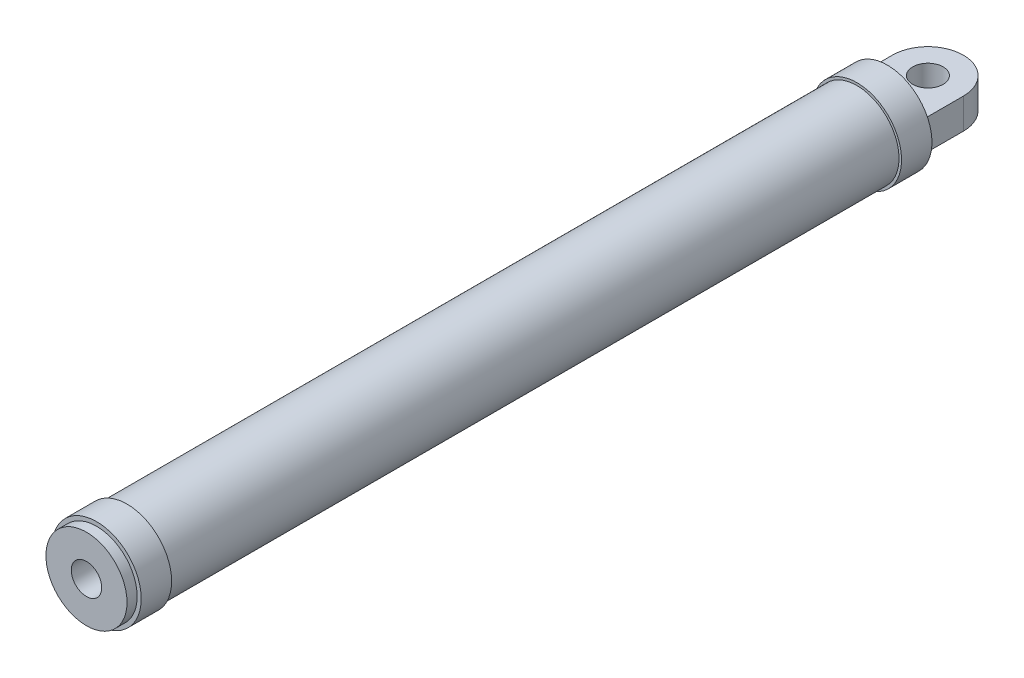
from build123d import *

# Parameters (mm, degrees)
SKETCH_1_R          = 41.5
EXTRUDE_1_DEPTH     = 720
SKETCH_2_R          = 44
EXTRUDE_2_DEPTH     = 30
EXTRUDE_START       = 30
SKETCH_3_R          = 44
EXTRUDE_3_DEPTH     = 30
SKETCH_4_R          = 40
EXTRUDE_4_DEPTH     = 10
SKETCH_6_R          = 15
EXTRUDE_6_DEPTH     = 15
SKETCH_5_R          = 15
CUT_EXTRUDE_1_DEPTH = 220


with BuildPart() as part:
    # 草图1 → 拉伸1 (new body)
    with BuildSketch(Plane.XY):
        with Locations(Location((0, 0, 0), (0, 0, 180))):
            Circle(SKETCH_1_R)
    extrude(amount=EXTRUDE_1_DEPTH)

    # 草图2 → 拉伸2 (add)
    with BuildSketch(Plane.XY.offset(720)):
        Circle(SKETCH_2_R)
    extrude(amount=EXTRUDE_2_DEPTH)

    # 草图3 → 拉伸3 (add)
    with BuildSketch(Plane(origin=(0, 0, 0), x_dir=(-1, 0, 0), z_dir=(0, 0, -1)).offset(EXTRUDE_START)):
        with Locations(Location((0, 0, 0), (0, 0, 180))):
            Circle(SKETCH_3_R)
    extrude(amount=-EXTRUDE_3_DEPTH)

    # 草图4 → 拉伸4 (add)
    with BuildSketch(Plane.XY.offset(750)):
        Circle(SKETCH_4_R)
    extrude(amount=EXTRUDE_4_DEPTH)

    # 草图6 → 拉伸6 (add, symmetric)
    with BuildSketch(Plane(origin=(0, 0, 0), x_dir=(1, 0, 0), z_dir=(0, 1, 0))):
        with BuildLine():
            Line((-35, 70), (-35, 30))
            Line((-35, 30), (35, 30))
            Line((35, 30), (35, 70))
            ThreePointArc((35, 70), (0, 105), (-35, 70))
        make_face()
        with Locations(Location((0, 70, 0), (0, 0, 270))):
            Circle(SKETCH_6_R, mode=Mode.SUBTRACT)
    extrude(amount=EXTRUDE_6_DEPTH, both=True)

    # 草图5 → 切除-拉伸1 (cut)
    with BuildSketch(Plane.XY.offset(760)):
        Circle(SKETCH_5_R)
    extrude(amount=-CUT_EXTRUDE_1_DEPTH, mode=Mode.SUBTRACT)


solid = part.part
